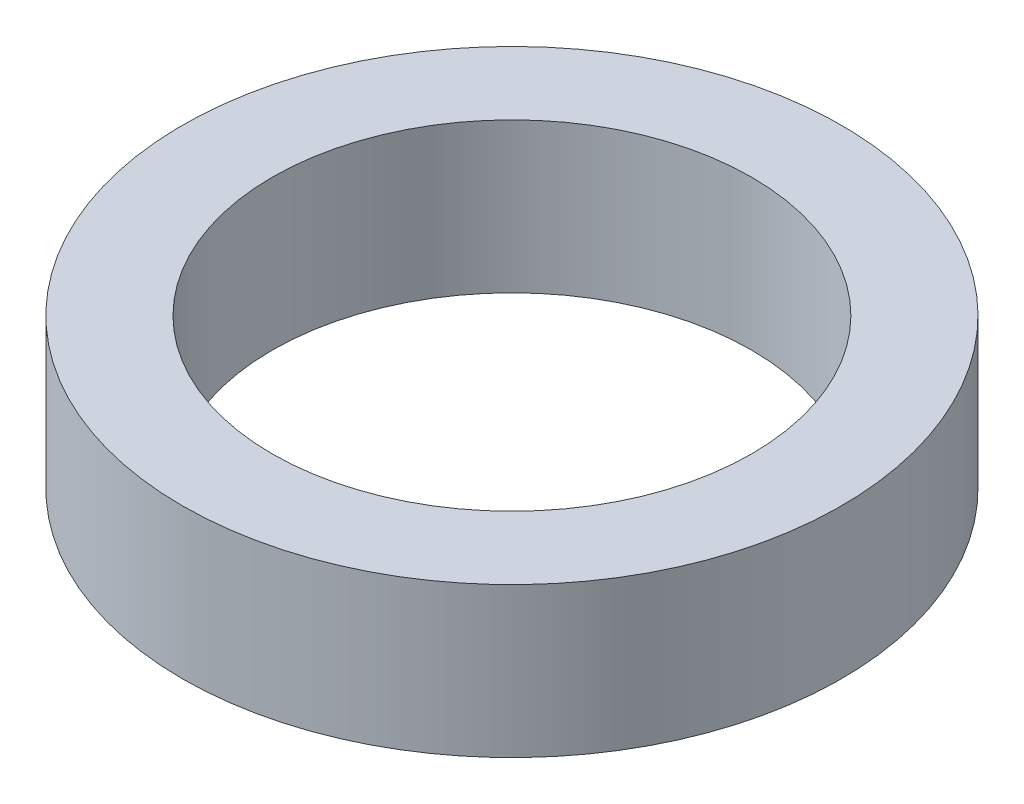
from build123d import *

# Parameters (mm, degrees)
SKETCH1_R           = 11
SKETCH1_R_2         = 8
BOSS_EXTRUDE1_DEPTH = 5


with BuildPart() as part:
    # Sketch1 → Boss-Extrude1 (new body)
    with BuildSketch(Plane(origin=(0, 0, 0), x_dir=(1, 0, 0), z_dir=(0, 1, 0))):
        with Locations(Location((0, 0, 0), (0, 0, 270))):
            Circle(SKETCH1_R)
        with Locations(Location((0, 0, 0), (0, 0, 270))):
            Circle(SKETCH1_R_2, mode=Mode.SUBTRACT)
    extrude(amount=BOSS_EXTRUDE1_DEPTH)


solid = part.part
